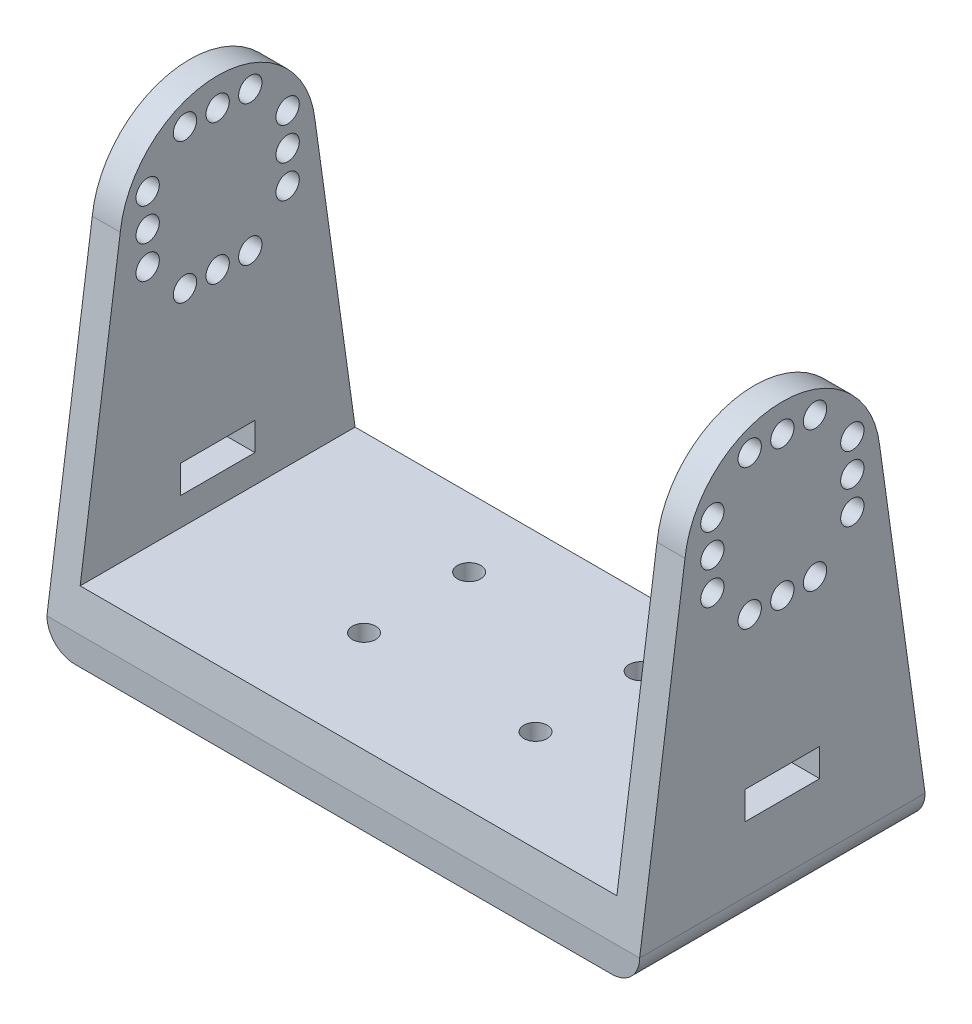
from build123d import *

# Parameters (mm, degrees)
SKETCH2_W               = 63.52
SKETCH2_H               = 30.59
BOSS_EXTRUDE1_DEPTH     = 7
SKETCH3_W               = 3
SKETCH3_H               = 30.59
BOSS_EXTRUDE2_DEPTH     = 40
FILLET2_R               = 3
SKETCH4_R               = 1.25
CUT_EXTRUDE2_DEPTH      = 70
CUT_EXTRUDE4_DEPTH      = 6
CUT_EXTRUDE4_DEPTH_BACK = 20
SKETCH7_R               = 1.25
SKETCH7_R_2             = 1.249999994
SKETCH11_W              = 4
SKETCH11_H              = 3
CUT_EXTRUDE5_DEPTH      = 80


with BuildPart() as part:
    # Sketch2 → Boss-Extrude1 (new body)
    with BuildSketch(Plane(origin=(0, 0, 0), x_dir=(1, 0, 0), z_dir=(0, 1, 0))):
        with Locations((-20.26308022, 14.924105874)):
            Rectangle(SKETCH2_W, SKETCH2_H)
    extrude(amount=BOSS_EXTRUDE1_DEPTH)

    # Sketch3 → Boss-Extrude2 (add)
    with BuildSketch(Plane(origin=(0, 7, 0), x_dir=(1, 0, 0), z_dir=(0, 1, 0))):
        with Locations((-50.52308022, 14.924105874)):
            Rectangle(SKETCH3_W, SKETCH3_H)
        with Locations((9.99691978, 14.924105874)):
            Rectangle(SKETCH3_W, SKETCH3_H)
    extrude(amount=BOSS_EXTRUDE2_DEPTH)

    # Fillet2
    fillet2_edges = [part.edges().sort_by_distance(p)[0] for p in [
        (11.49691978, 0, -14.924105874),
        (-52.02308022, 0, -14.924105874),
    ]]
    fillet(fillet2_edges, radius=FILLET2_R)

    # Sketch4 → Cut-Extrude2 (cut)
    with BuildSketch(Plane.ZY.offset(52.02308022)):
        with BuildLine():
            ThreePointArc((-25.359340899, 37.664418298), (-21.924948962, 44.325483759), (-14.924105874, 47))
            Line((-14.924105874, 47), (-30.219105874, 47))
            Line((-30.219105874, 47), (-30.219105874, 3))
            Line((-30.219105874, 3), (-25.359340899, 37.664418298))
        make_face()
        with BuildLine():
            Line((0.370894126, 47), (-14.924105874, 47))
            ThreePointArc((-14.924105874, 47), (-7.923262787, 44.325483759), (-4.488870849, 37.664418298))
            Line((-4.488870849, 37.664418298), (0.370894126, 3))
            Line((0.370894126, 3), (0.370894126, 47))
        make_face()
        with Locations((-7.424105874, 36.5)):
            Circle(SKETCH4_R)
        with Locations((-7.424105874, 40)):
            Circle(SKETCH4_R)
        with Locations((-7.424105874, 33)):
            Circle(SKETCH4_R)
        with Locations((-14.924105874, 29)):
            Circle(SKETCH4_R)
        with Locations((-11.424105874, 29)):
            Circle(SKETCH4_R)
        with Locations((-18.424105874, 29)):
            Circle(SKETCH4_R)
        with Locations((-22.424105874, 36.5)):
            Circle(SKETCH4_R)
        with Locations((-22.424105874, 40)):
            Circle(SKETCH4_R)
        with Locations((-22.424105874, 33)):
            Circle(SKETCH4_R)
        with Locations((-11.424105874, 44)):
            Circle(SKETCH4_R)
        with Locations((-18.424105874, 44)):
            Circle(SKETCH4_R)
        with Locations((-14.924105874, 44)):
            Circle(SKETCH4_R)
    extrude(amount=-CUT_EXTRUDE2_DEPTH, mode=Mode.SUBTRACT)

    # Sketch7 → Cut-Extrude4 (cut, two sides: drawn at the far end of the back side and taken through both)
    with BuildSketch(Plane(origin=(0, 7, 0), x_dir=(1, 0, 0), z_dir=(0, 1, 0)).offset(-CUT_EXTRUDE4_DEPTH_BACK)):
        with Locations(Location((-11.073080223, 11.041478624, 0), (0, 0, 270))):
            Circle(SKETCH7_R)
        with Locations(Location((-11.073080223, 22.304987192, 0), (0, 0, 270))):
            Circle(SKETCH7_R)
        with Locations(Location((-29.454080223, 11.041478624, 0), (0, 0, 270))):
            Circle(SKETCH7_R_2)
        with Locations(Location((-29.454080223, 22.304987192, 0), (0, 0, 270))):
            Circle(SKETCH7_R)
    extrude(amount=CUT_EXTRUDE4_DEPTH + CUT_EXTRUDE4_DEPTH_BACK, mode=Mode.SUBTRACT)

    # Sketch11 → Cut-Extrude5 (cut)
    with BuildSketch(Plane.ZY.offset(52.02308022)):
        with Locations((-16.924105874, 11.5)):
            Rectangle(SKETCH11_W, SKETCH11_H)
        with Locations((-12.924105874, 11.5)):
            Rectangle(SKETCH11_W, SKETCH11_H)
    extrude(amount=-CUT_EXTRUDE5_DEPTH, mode=Mode.SUBTRACT)


solid = part.part
